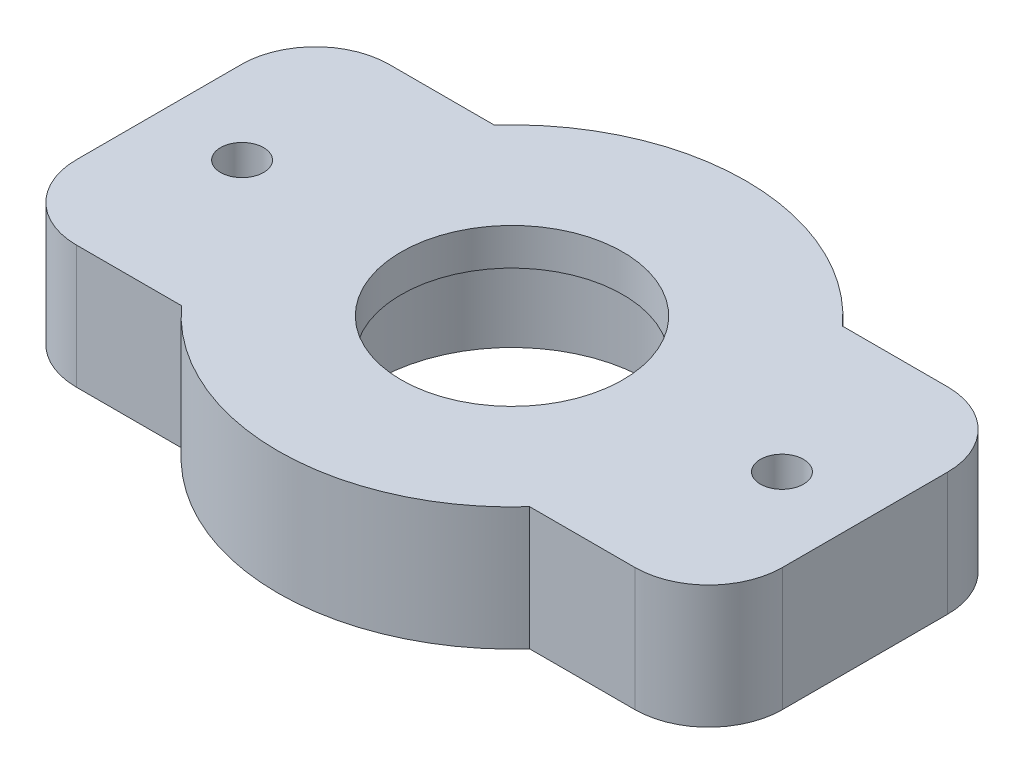
from build123d import *

# Parameters (mm, degrees)
SKETCH1_R           = 11
SKETCH1_R_2         = 1.75
BOSS_EXTRUDE1_DEPTH = 10
BOSS_EXTRUDE2_START = -3
SKETCH2_R           = 11
SKETCH2_R_2         = 9
BOSS_EXTRUDE2_DEPTH = 3
FILLET1_R           = 6


with BuildPart() as part:
    # Sketch1 → Boss-Extrude1 (new body)
    with BuildSketch(Plane(origin=(0, 0, 0), x_dir=(1, 0, 0), z_dir=(0, 1, 0))):
        with BuildLine():
            Line((28.670310217, -12.7), (14.131878856, -12.7))
            ThreePointArc((14.131878856, -12.7), (0, -19), (-14.131878856, -12.7))
            Line((-14.131878856, -12.7), (-28.670310217, -12.7))
            Line((-28.670310217, -12.7), (-28.670310217, 12.7))
            Line((-28.670310217, 12.7), (-14.131878856, 12.7))
            ThreePointArc((-14.131878856, 12.7), (0, 19), (14.131878856, 12.7))
            Line((14.131878856, 12.7), (28.670310217, 12.7))
            Line((28.670310217, 12.7), (28.670310217, -12.7))
        make_face()
        with Locations(Location((0, 0, 0), (0, 0, 270))):
            Circle(SKETCH1_R, mode=Mode.SUBTRACT)
        with Locations(Location((21.920310217, 0, 0), (0, 0, 270))):
            Circle(SKETCH1_R_2, mode=Mode.SUBTRACT)
        with Locations(Location((-21.920310217, 0, 0), (0, 0, 270))):
            Circle(SKETCH1_R_2, mode=Mode.SUBTRACT)
    extrude(amount=BOSS_EXTRUDE1_DEPTH)

    # Sketch2 → Boss-Extrude2 (add)
    with BuildSketch(Plane(origin=(0, 10, 0), x_dir=(1, 0, 0), z_dir=(0, 1, 0)).offset(BOSS_EXTRUDE2_START)):
        with Locations(Location((0, 0, 0), (0, 0, 270))):
            Circle(SKETCH2_R)
        with Locations(Location((0, 0, 0), (0, 0, 270))):
            Circle(SKETCH2_R_2, mode=Mode.SUBTRACT)
    extrude(amount=BOSS_EXTRUDE2_DEPTH)

    # Fillet1
    fillet1_edges = [part.edges().sort_by_distance(p)[0] for p in [
        (28.670310217, 5, -12.7),
        (28.670310217, 5, 12.7),
        (-28.670310217, 5, 12.7),
        (-28.670310217, 5, -12.7),
    ]]
    fillet(fillet1_edges, radius=FILLET1_R)


solid = part.part
